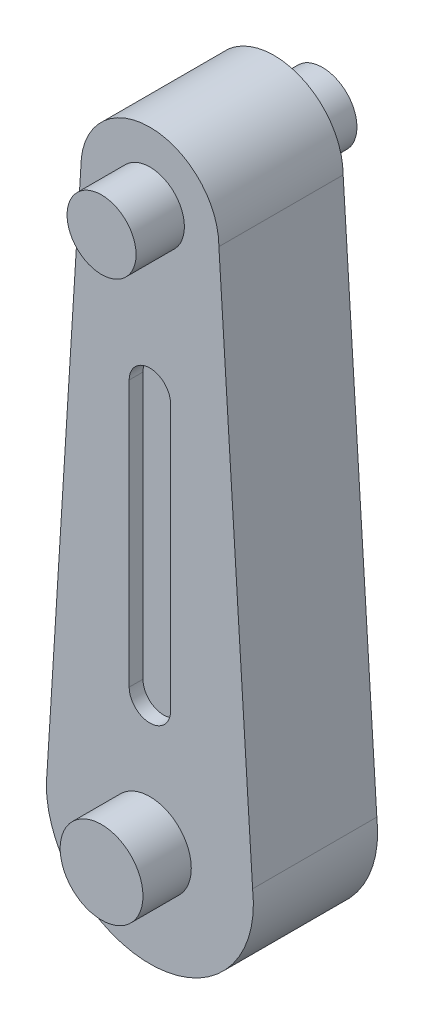
from build123d import *

# Parameters (mm, degrees)
BOSS_EXTRUDE1_DEPTH = 45
SKETCH2_R           = 25
SKETCH2_R_2         = 30
BOSS_EXTRUDE2_DEPTH = 35
CUT_EXTRUDE1_DEPTH  = 10


with BuildPart() as part:
    # Sketch1 → Boss-Extrude1 (new, symmetric)
    with BuildSketch(Plane.XY):
        with BuildLine():
            Line((-50, 212.5), (-74.416342412, -178.161478599))
            ThreePointArc((-74.416342412, -178.161478599), (0, -262.5), (74.416342412, -178.161478599))
            Line((74.416342412, -178.161478599), (50, 212.5))
            ThreePointArc((50, 212.5), (0, 262.5), (-50, 212.5))
        make_face()
    extrude(amount=BOSS_EXTRUDE1_DEPTH, both=True)

    # Sketch2 → Boss-Extrude2 (add)
    with BuildSketch(Plane.XY.offset(45)):
        with Locations((0, 212.5)):
            Circle(SKETCH2_R)
        with Locations((0, -187.5)):
            Circle(SKETCH2_R_2)
    boss_extrude2 = extrude(amount=BOSS_EXTRUDE2_DEPTH)

    # Mirror1: Boss-Extrude2 across plane
    add(boss_extrude2.mirror(Plane.XY))

    # Sketch3 → Cut-Extrude1 (cut)
    with BuildSketch(Plane.XY.offset(45)):
        with BuildLine():
            Line((15, 96.352828314), (15, -96.352828314))
            ThreePointArc((15, -96.352828314), (0, -111.352828314), (-15, -96.352828314))
            Line((-15, -96.352828314), (-15, 96.352828314))
            ThreePointArc((-15, 96.352828314), (0, 111.352828314), (15, 96.352828314))
        make_face()
    cut_extrude1 = extrude(amount=-CUT_EXTRUDE1_DEPTH, mode=Mode.SUBTRACT)

    # Mirror2: Cut-Extrude1 across plane
    add(cut_extrude1.mirror(Plane.XY), mode=Mode.SUBTRACT)


solid = part.part
